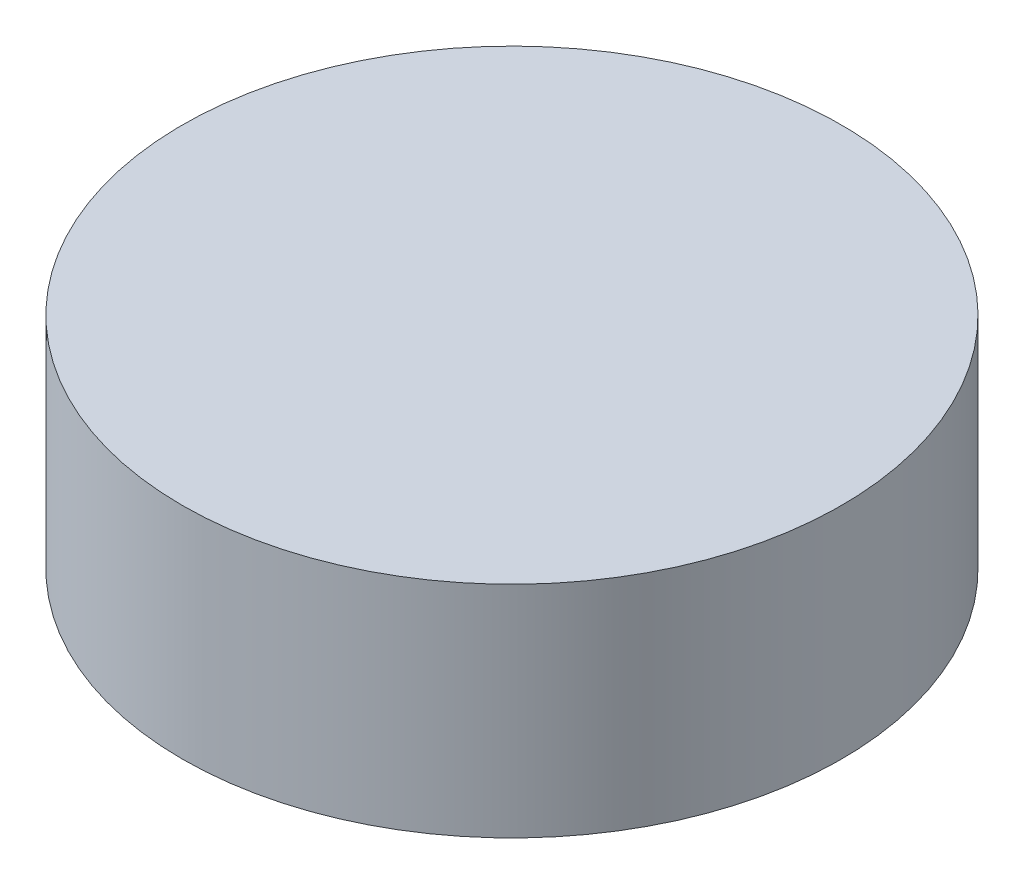
from build123d import *

# Parameters (mm, degrees)
SKETCH1_R           = 75
BOSS_EXTRUDE1_DEPTH = 50


with BuildPart() as part:
    # Sketch1 → Boss-Extrude1 (new body)
    with BuildSketch(Plane(origin=(0, 0, 0), x_dir=(1, 0, 0), z_dir=(0, 1, 0))):
        with Locations(Location((0, 0, 0), (0, 0, 270))):
            Circle(SKETCH1_R)
    extrude(amount=BOSS_EXTRUDE1_DEPTH)


solid = part.part
